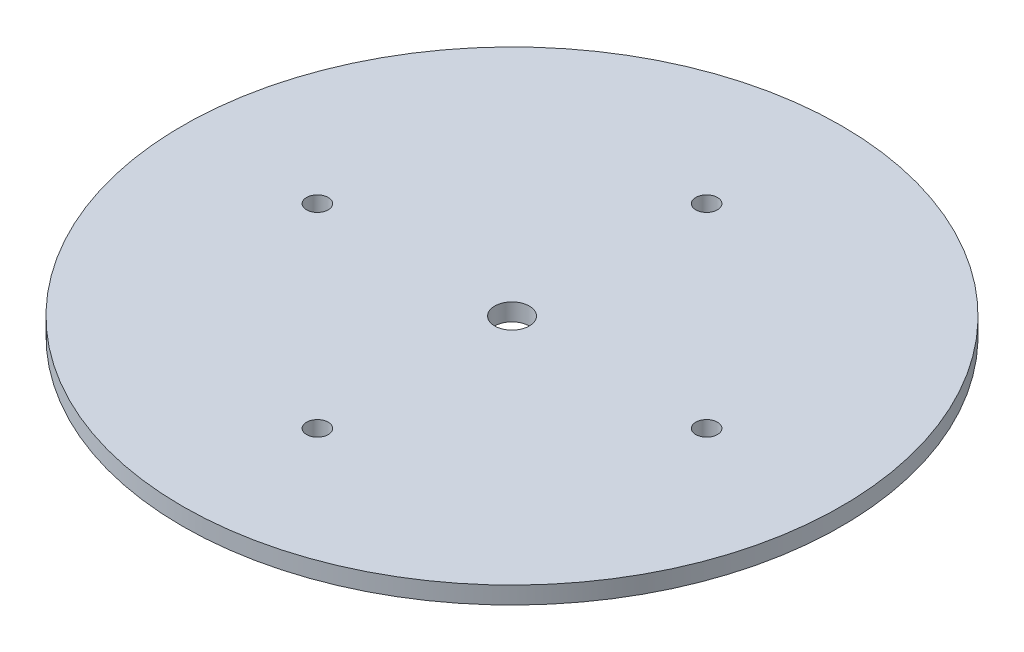
from build123d import *

# Parameters (mm, degrees)
SKETCH1_R           = 76.2
SKETCH1_R_2         = 2.5
SKETCH1_R_3         = 4
BOSS_EXTRUDE1_DEPTH = 4


with BuildPart() as part:
    # Sketch1 → Boss-Extrude1 (new body)
    with BuildSketch(Plane(origin=(0, 0, 0), x_dir=(1, 0, 0), z_dir=(0, 1, 0))):
        with Locations(Location((0, 0, 0), (0, 0, 270))):
            Circle(SKETCH1_R)
        with Locations(Location((-45, 0, 0), (0, 0, 270))):
            Circle(SKETCH1_R_2, mode=Mode.SUBTRACT)
        with Locations(Location((45, 0, 0), (0, 0, 270))):
            Circle(SKETCH1_R_2, mode=Mode.SUBTRACT)
        with Locations(Location((0, 0, 0), (0, 0, 270))):
            Circle(SKETCH1_R_3, mode=Mode.SUBTRACT)
        with Locations(Location((0, -45, 0), (0, 0, 270))):
            Circle(SKETCH1_R_2, mode=Mode.SUBTRACT)
        with Locations(Location((0, 45, 0), (0, 0, 270))):
            Circle(SKETCH1_R_2, mode=Mode.SUBTRACT)
    extrude(amount=BOSS_EXTRUDE1_DEPTH)


solid = part.part
